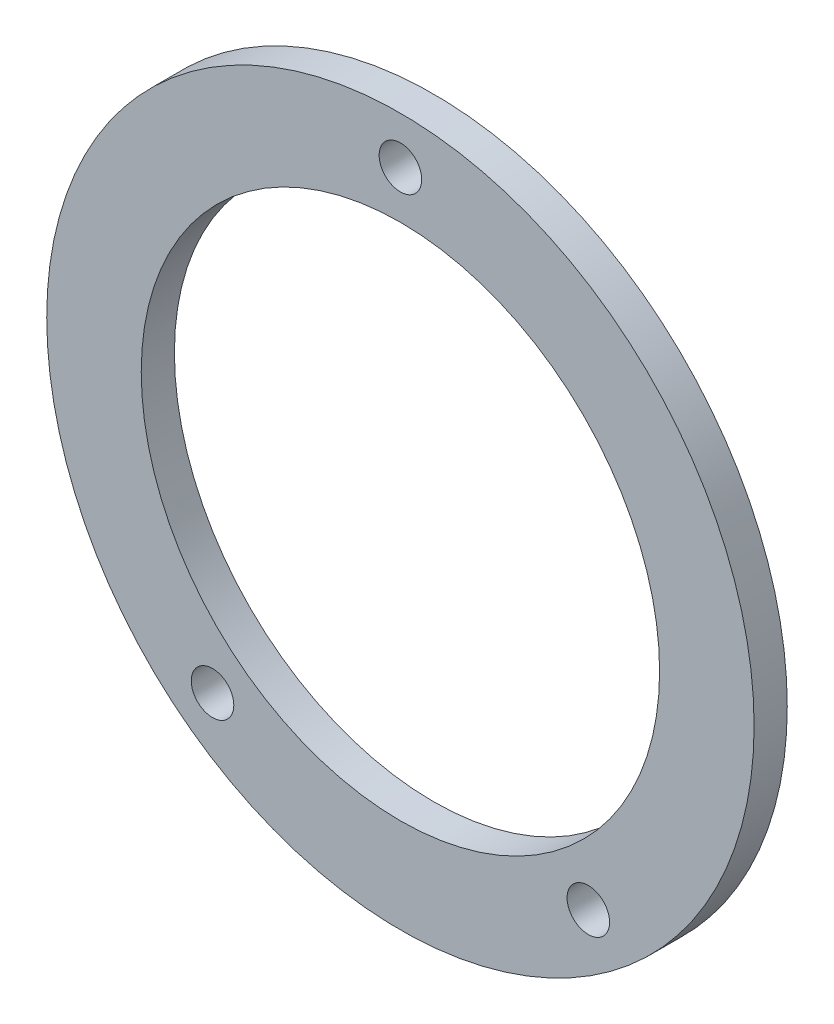
from build123d import *

# Parameters (mm, degrees)
ESQUISSE1_R        = 32
ESQUISSE1_R_2      = 23.45
ESQUISSE1_R_3      = 1.925
BOSS_EXTRU_1_DEPTH = 3


with BuildPart() as part:
    # Esquisse1 → Boss.-Extru.1 (new body)
    with BuildSketch(Plane.XY):
        Circle(ESQUISSE1_R)
        Circle(ESQUISSE1_R_2, mode=Mode.SUBTRACT)
        with Locations((16.999999998, -21.933137031)):
            Circle(ESQUISSE1_R_3, mode=Mode.SUBTRACT)
        with Locations((-16.999999999, -21.933137031)):
            Circle(ESQUISSE1_R_3, mode=Mode.SUBTRACT)
        with Locations((0, 27.75)):
            Circle(ESQUISSE1_R_3, mode=Mode.SUBTRACT)
    extrude(amount=BOSS_EXTRU_1_DEPTH)


solid = part.part
